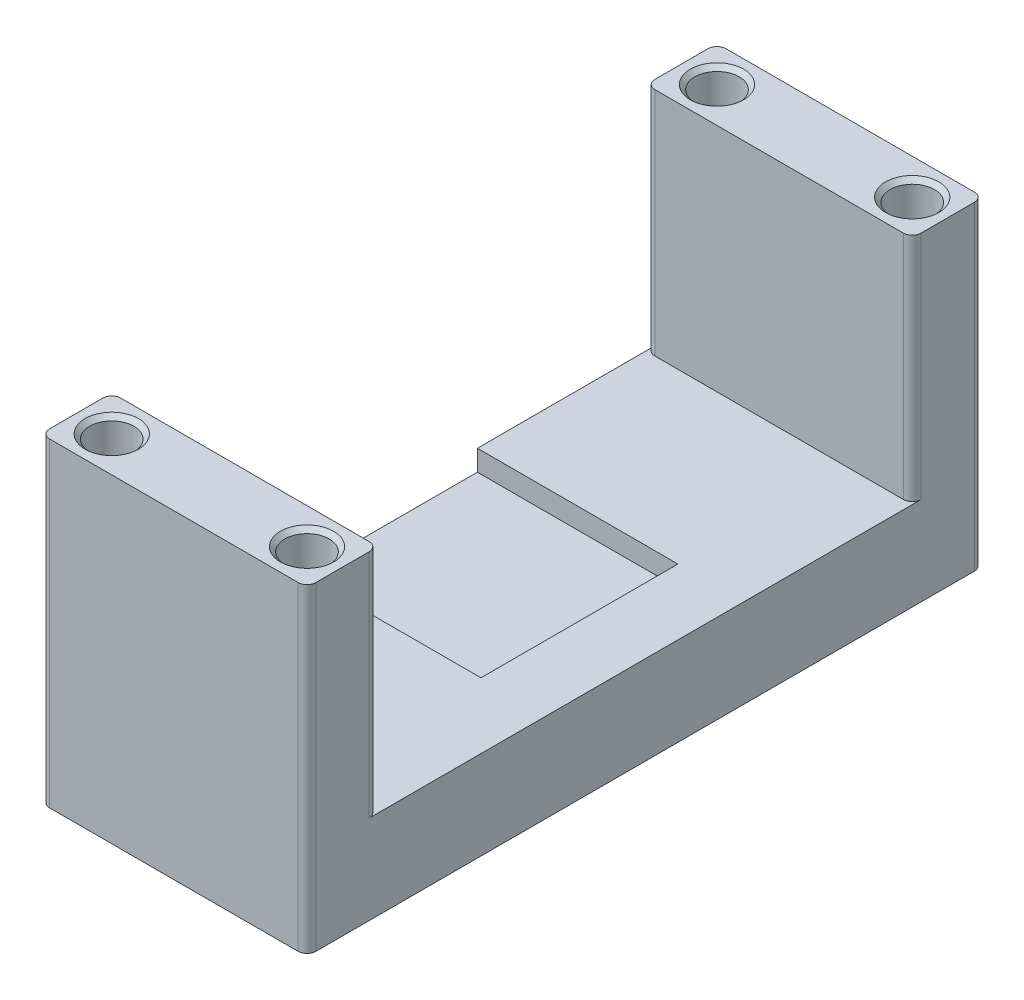
from build123d import *

# Parameters (mm, degrees)
SKETCH1_W                       = 30
SKETCH1_H                       = 76.2
BOSS_EXTRUDE1_DEPTH             = 10
SKETCH2_W                       = 22.6
SKETCH2_H                       = 22.2
CUT_EXTRUDE2_DEPTH              = 2.335
SKETCH3_W                       = 30
SKETCH3_H                       = 8
BOSS_EXTRUDE2_DEPTH             = 26
F_5_0MM_DOWEL_HOLE1_D           = 5
F_5_0MM_DOWEL_HOLE1_DEPTH       = 4.6
F_5_0MM_DOWEL_HOLE1_CSINK_D     = 6
F_5_0MM_DOWEL_HOLE1_CSINK_ANGLE = 90
FILLET1_R                       = 1


with BuildPart() as part:
    # Sketch1 → Boss-Extrude1 (new body)
    with BuildSketch(Plane(origin=(0, 0, 0), x_dir=(1, 0, 0), z_dir=(0, 1, 0))):
        Rectangle(SKETCH1_W, SKETCH1_H)
    extrude(amount=-BOSS_EXTRUDE1_DEPTH)

    # Sketch2 → Cut-Extrude2 (cut)
    with BuildSketch(Plane(origin=(0, 0, 0), x_dir=(1, 0, 0), z_dir=(0, 1, 0))):
        with Locations((-3.7, 0)):
            Rectangle(SKETCH2_W, SKETCH2_H)
    extrude(amount=-CUT_EXTRUDE2_DEPTH, mode=Mode.SUBTRACT)

    # Sketch3 → Boss-Extrude2 (add)
    with BuildSketch(Plane(origin=(0, 0, 0), x_dir=(1, 0, 0), z_dir=(0, 1, 0))):
        with Locations((0, 34.1)):
            Rectangle(SKETCH3_W, SKETCH3_H)
        with Locations((0, -34.1)):
            Rectangle(SKETCH3_W, SKETCH3_H)
    extrude(amount=BOSS_EXTRUDE2_DEPTH)

    # Ø5.0mm Dowel Hole1
    with Locations(Plane(origin=(0, 26, 0), x_dir=(1, 0, 0), z_dir=(0, 1, 0))):
        with Locations((-11, 34.1), (11, 34.1), (11, -34.1), (-11, -34.1)):
            CounterSinkHole(F_5_0MM_DOWEL_HOLE1_D / 2, F_5_0MM_DOWEL_HOLE1_CSINK_D / 2, depth=F_5_0MM_DOWEL_HOLE1_DEPTH, counter_sink_angle=F_5_0MM_DOWEL_HOLE1_CSINK_ANGLE)

    # Fillet1
    fillet1_edges = [part.edges().sort_by_distance(p)[0] for p in [
        (-15, 13, -30.1),
        (15, 13, -30.1),
        (-15, 13, 30.1),
        (15, 13, 30.1),
        (-15, 8, -38.1),
        (15, 8, -38.1),
        (15, 8, 38.1),
        (-15, 8, 38.1),
    ]]
    fillet(fillet1_edges, radius=FILLET1_R)


solid = part.part
